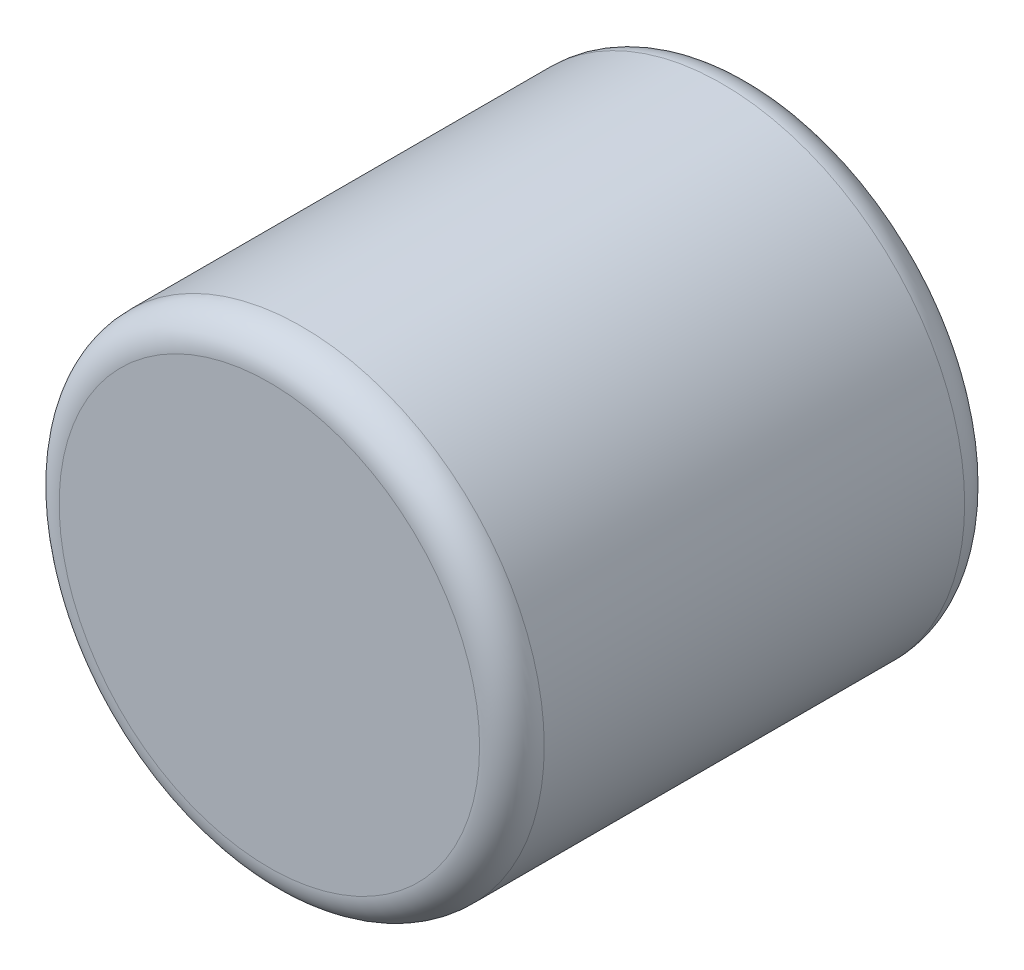
from build123d import *

# Parameters (mm, degrees)
SKETCH1_R           = 1.5
BOSS_EXTRUDE1_DEPTH = 3
FILLET1_R           = 0.2


with BuildPart() as part:
    # Sketch1 → Boss-Extrude1 (new body)
    with BuildSketch(Plane.XY):
        Circle(SKETCH1_R)
    extrude(amount=BOSS_EXTRUDE1_DEPTH)

    # Fillet1
    fillet1_edges = [part.edges().sort_by_distance(p)[0] for p in [
        (-1.5, 0, 0),
        (-1.5, 0, 3),
    ]]
    fillet(fillet1_edges, radius=FILLET1_R)


solid = part.part
